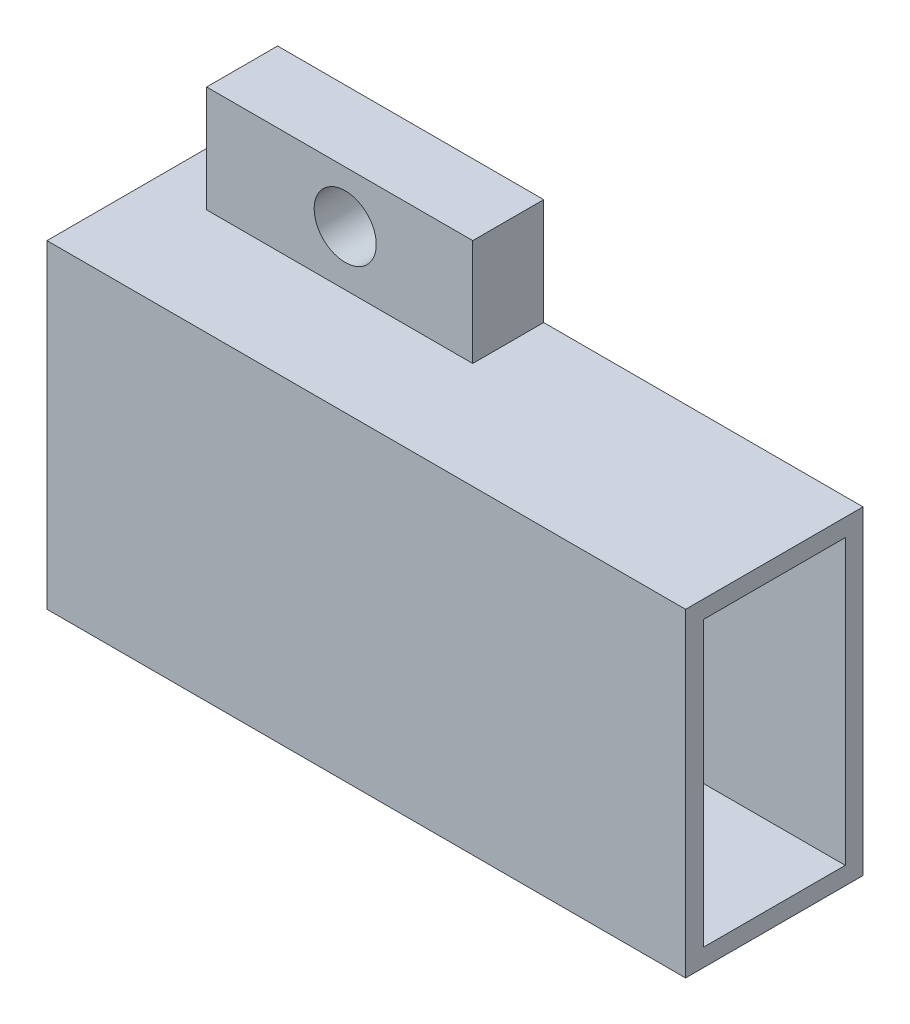
from build123d import *

# Parameters (mm, degrees)
SKETCH1_W           = 36
SKETCH1_H           = 18
BOSS_EXTRUDE1_DEPTH = 10
SHELL1_T            = -1
SKETCH2_R           = 3
CUT_EXTRUDE1_DEPTH  = 8
SKETCH3_W           = 15
SKETCH3_H           = 6
BOSS_EXTRUDE2_DEPTH = 4
SKETCH4_R           = 1.75
CUT_EXTRUDE2_DEPTH  = 12


with BuildPart() as part:
    # Sketch1 → Boss-Extrude1 (new body)
    with BuildSketch(Plane.XY):
        Rectangle(SKETCH1_W, SKETCH1_H)
    extrude(amount=BOSS_EXTRUDE1_DEPTH)

    # Shell1
    shell1_openings = [part.faces().sort_by_distance(p)[0] for p in [
        (18, 0, 5),
    ]]
    offset(amount=SHELL1_T, openings=shell1_openings, kind=Kind.INTERSECTION)

    # Sketch2 → Cut-Extrude1 (cut)
    with BuildSketch(Plane.ZY.offset(18)):
        with Locations(Location((4.221831089, 0, 0), (0, 0, 270))):
            Circle(SKETCH2_R)
    extrude(amount=-CUT_EXTRUDE1_DEPTH, mode=Mode.SUBTRACT)

    # Sketch3 → Boss-Extrude2 (add)
    with BuildSketch(Plane(origin=(0, 0, 0), x_dir=(-1, 0, 0), z_dir=(0, 0, -1))):
        with Locations((7.5, 12)):
            Rectangle(SKETCH3_W, SKETCH3_H)
        with Locations((7.5, -12)):
            Rectangle(SKETCH3_W, SKETCH3_H)
    extrude(amount=-BOSS_EXTRUDE2_DEPTH)

    # Sketch4 → Cut-Extrude2 (cut)
    with BuildSketch(Plane(origin=(0, 0, 0), x_dir=(-1, 0, 0), z_dir=(0, 0, -1))):
        with Locations((7.189144768, 12.089124741)):
            Circle(SKETCH4_R)
        with Locations((7.189144768, -12.045861265)):
            Circle(SKETCH4_R)
    extrude(amount=-CUT_EXTRUDE2_DEPTH, mode=Mode.SUBTRACT)


solid = part.part
